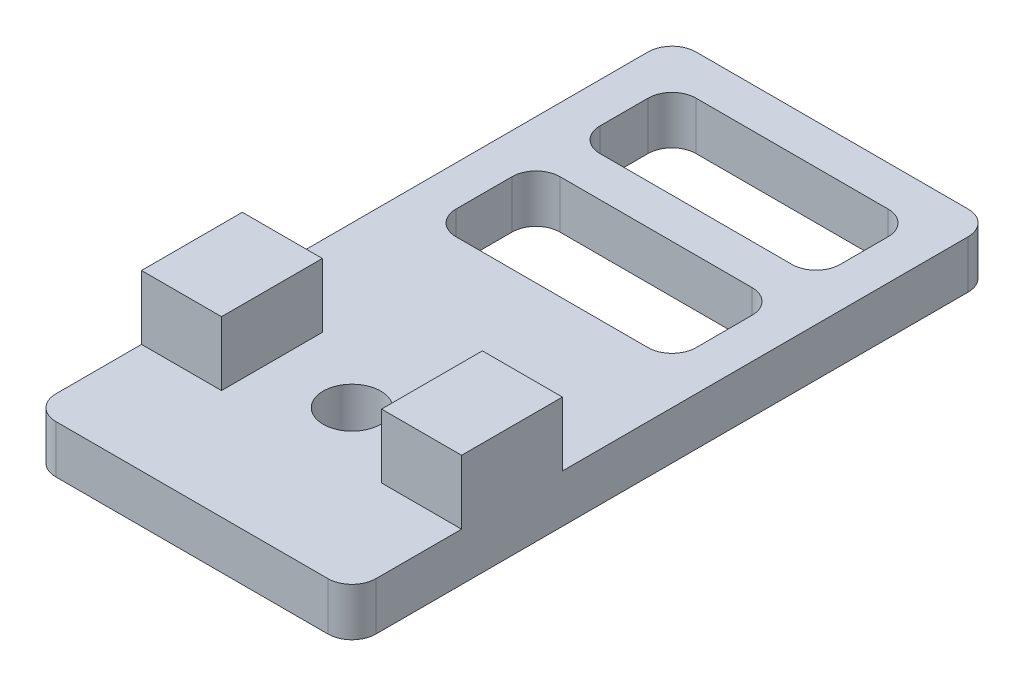
from build123d import *

# Parameters (mm, degrees)
SKETCH1_W                = 20
SKETCH1_H                = 40
SKETCH1_W_2              = 15
SKETCH1_H_2              = 15
SKETCH1_H_3              = 2.5
BOSS_EXTRUDE1_DEPTH      = 3
SKETCH2_W                = 5
SKETCH2_H                = 6.3
BOSS_EXTRUDE2_DEPTH      = 4
M3_CLEARANCE_HOLE1_D     = 3.6
M3_CLEARANCE_HOLE1_DEPTH = 10
M3_CLEARANCE_HOLE1_TIP   = 1.081549114
FILLET1_R                = 1.5


with BuildPart() as part:
    # Sketch1 → Boss-Extrude1 (new body)
    # profile 1 of 2: a face of its own
    with BuildSketch(Plane(origin=(0, 0, 0), x_dir=(1, 0, 0), z_dir=(0, 1, 0))):
        with Locations((10, 20)):
            Rectangle(SKETCH1_W, SKETCH1_H)
        with Locations((10, 30)):
            Rectangle(SKETCH1_W_2, SKETCH1_H_2, mode=Mode.SUBTRACT)
    # profile 2 of 2: a face of its own
    with BuildSketch(Plane(origin=(0, 0, 0), x_dir=(1, 0, 0), z_dir=(0, 1, 0))):
        with Locations((10, 30.25)):
            Rectangle(SKETCH1_W_2, SKETCH1_H_3)
    extrude(amount=BOSS_EXTRUDE1_DEPTH)

    # Sketch2 → Boss-Extrude2 (add)
    with BuildSketch(Plane(origin=(0, 3, 0), x_dir=(1, 0, 0), z_dir=(0, 1, 0))):
        with Locations((2.5, 10)):
            Rectangle(SKETCH2_W, SKETCH2_H)
        with Locations((17.5, 10)):
            Rectangle(SKETCH2_W, SKETCH2_H)
    extrude(amount=BOSS_EXTRUDE2_DEPTH)

    # M3 Clearance Hole1
    with Locations(Plane(origin=(0, 3, 0), x_dir=(1, 0, 0), z_dir=(0, 1, 0))):
        with Locations((10, 10)):
            Hole(M3_CLEARANCE_HOLE1_D / 2, depth=M3_CLEARANCE_HOLE1_DEPTH)
            with Locations((0, 0, -(M3_CLEARANCE_HOLE1_DEPTH + M3_CLEARANCE_HOLE1_TIP / 2))):  # 118° drill point
                Cone(0, M3_CLEARANCE_HOLE1_D / 2, M3_CLEARANCE_HOLE1_TIP, mode=Mode.SUBTRACT)

    # Fillet1
    fillet1_edges = [part.edges().sort_by_distance(p)[0] for p in [
        (2.5, 1.5, -37.5),
        (2.5, 1.5, -22.5),
        (17.5, 1.5, -22.5),
        (17.5, 1.5, -37.5),
        (0, 1.5, 0),
        (0, 1.5, -40),
        (20, 1.5, -40),
        (20, 1.5, 0),
        (2.5, 1.5, -31.5),
        (2.5, 1.5, -29),
        (17.5, 1.5, -31.5),
        (17.5, 1.5, -29),
    ]]
    fillet(fillet1_edges, radius=FILLET1_R)


solid = part.part
